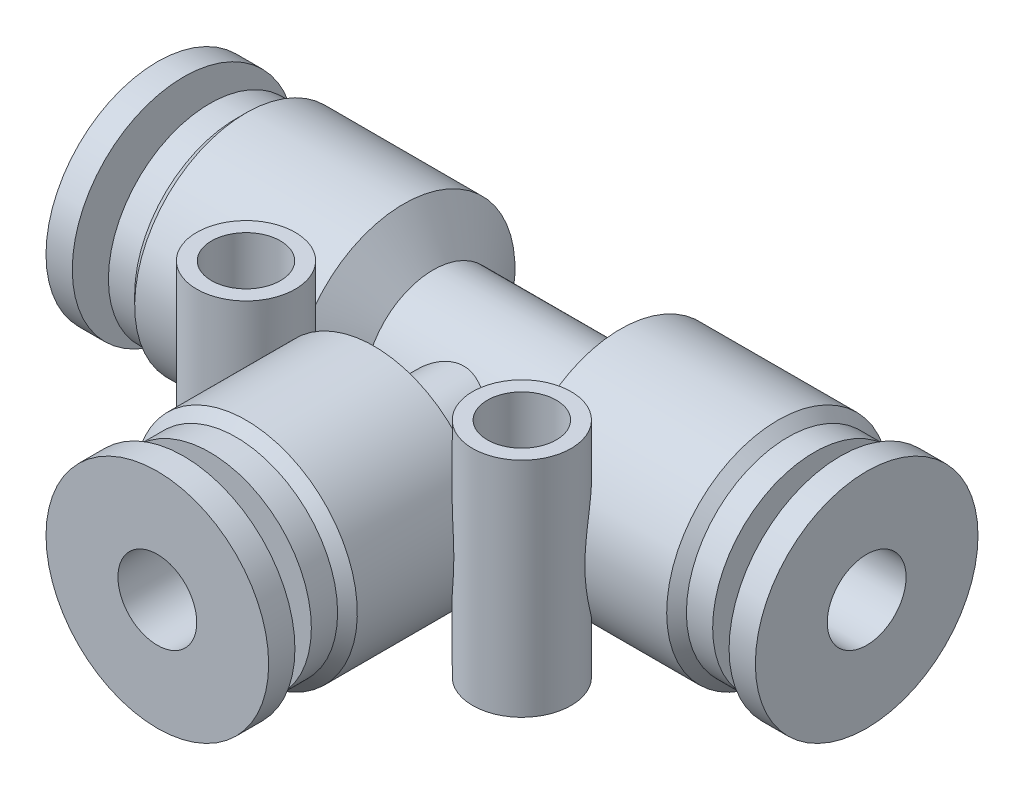
from build123d import *

# Parameters (mm, degrees)
BOSS_EXTRUDE1_DEPTH      = 5.65
BOSS_EXTRUDE1_DEPTH_BACK = 5.65
SKETCH6_R                = 2.5
SKETCH7_R                = 1.75
CUT_EXTRUDE1_DEPTH       = 22.626141761
BOSS_EXTRUDE3_DEPTH      = 1
BOSS_EXTRUDE3_DEPTH_BACK = 1
SKETCH8_W                = 10.3
SKETCH8_H                = 5
CHAMFER1_SIZE            = 0.5
SKETCH9_R                = 5.15
BOSS_EXTRUDE4_DEPTH      = 1.3333
BOSS_EXTRUDE5_START      = 1.3333
SKETCH10_R               = 5.15
BOSS_EXTRUDE5_DEPTH      = 1.3333
SKETCH11_R               = 5.15
BOSS_EXTRUDE6_DEPTH      = 1.333
SKETCH14_R               = 2
CUT_EXTRUDE2_DEPTH       = 39.36556716
CUT_EXTRUDE3_REACH       = 32.253
CUT_EXTRUDE3_END_RADIUS  = 2
SKETCH16_R               = 2


with BuildPart() as part:
    # Sketch4 → Revolve1 (revolve)
    with BuildSketch(Plane(origin=(0, 0, 0), x_dir=(1, 0, 0), z_dir=(0, 1, 0)), mode=Mode.PRIVATE) as revolve1_sk:
        Polygon((-14, 6.35), (-14, 12), (-5.5, 12), (-4, 9.85), (4, 9.85), (5.5, 12), (14, 12), (14, 6.35), align=None)
    revolve(revolve1_sk.sketch.rotate(Axis((-14, 0, -6.35), (1, 0, 0)), 180), axis=Axis((-14, 0, -6.35), (1, 0, 0)))

    # Sketch5 → Revolve2 (revolve)
    with BuildSketch(Plane(origin=(0, 0, 0), x_dir=(1, 0, 0), z_dir=(0, 1, 0)), mode=Mode.PRIVATE) as revolve2_sk:
        Polygon((-2.5, 2.85), (-2.5, 0.85), (-5.65, -0.65), (-5.65, -7.65), (0, -7.65), (0, 6.35), (-2.5, 6.35), align=None)
    revolve(revolve2_sk.sketch.rotate(Axis((0, 0, 7.65), (0, 0, -1)), 180), axis=Axis((0, 0, 7.65), (0, 0, -1)))

    # Sketch6 → Boss-Extrude1 (add, two sides: drawn at the far end of the back side and taken through both)
    with BuildSketch(Plane(origin=(0, 0, 0), x_dir=(1, 0, 0), z_dir=(0, 1, 0)).offset(-BOSS_EXTRUDE1_DEPTH_BACK)):
        with Locations(Location((-7, -0.15, 0), (0, 0, 270))):
            Circle(SKETCH6_R)
        with Locations(Location((7, -0.15, 0), (0, 0, 270))):
            Circle(SKETCH6_R)
    extrude(amount=BOSS_EXTRUDE1_DEPTH + BOSS_EXTRUDE1_DEPTH_BACK)

    # Sketch7 → Cut-Extrude1 (cut, through all)
    with BuildSketch(Plane(origin=(0, 5.65, 0), x_dir=(1, 0, 0), z_dir=(0, 1, 0))):
        with Locations(Location((7, -0.15, 0), (0, 0, 270))):
            Circle(SKETCH7_R)
        with Locations(Location((-7, -0.15, 0), (0, 0, 270))):
            Circle(SKETCH7_R)
    extrude(amount=-CUT_EXTRUDE1_DEPTH, mode=Mode.SUBTRACT)

    # Sketch8 → Boss-Extrude3 (add, two sides: drawn at the far end of the back side and taken through both)
    with BuildSketch(Plane(origin=(0, 0, 0), x_dir=(1, 0, 0), z_dir=(0, 1, 0)).offset(-BOSS_EXTRUDE3_DEPTH_BACK)):
        with Locations((0, 2)):
            Rectangle(SKETCH8_W, SKETCH8_H)
    extrude(amount=BOSS_EXTRUDE3_DEPTH + BOSS_EXTRUDE3_DEPTH_BACK)

    # Chamfer1
    chamfer1_edges = [part.edges().sort_by_distance(p)[0] for p in [
        (14, 0, -12),
        (-5.65, 0, 7.65),
        (-14, 0, -12),
    ]]
    chamfer(chamfer1_edges, length=CHAMFER1_SIZE)

    # Sketch9 → Boss-Extrude4 (add)
    with BuildSketch(Plane(origin=(14, 0, 0), x_dir=(0, 0, -1), z_dir=(1, 0, 0))):
        with Locations(Location((6.35, 0, 0), (0, 0, 180))):
            Circle(SKETCH9_R)
    extrude(amount=BOSS_EXTRUDE4_DEPTH)

    # Sketch10 → Boss-Extrude5 (add)
    with BuildSketch(Plane.ZY.offset(14).offset(BOSS_EXTRUDE5_START)):
        with Locations((-6.35, 0)):
            Circle(SKETCH10_R)
    extrude(amount=-BOSS_EXTRUDE5_DEPTH)

    # Sketch11 → Boss-Extrude6 (add)
    with BuildSketch(Plane.XY.offset(7.65)):
        with Locations(Location((0, 0, 0), (0, 0, 180))):
            Circle(SKETCH11_R)
    extrude(amount=BOSS_EXTRUDE6_DEPTH)

    # Sketch12 → Revolve3 (revolve)
    with BuildSketch(Plane(origin=(0, 0, 0), x_dir=(1, 0, 0), z_dir=(0, 1, 0))):
        Polygon((15.3333, 6.35), (17.99996, 6.35), (17.99996, 12), (16.66663, 12), (16.66663, 9.35), (15.3333, 9.35), align=None)
        Polygon((-16.66663, 9.35), (-15.3333, 9.35), (-15.3333, 6.35), (-17.99996, 6.35), (-17.99996, 12), (-16.66663, 12), align=None)
    revolve(axis=Axis((-15.3333, 0, -6.35), (-1, 0, 0)))

    # Sketch13 → Revolve4 (revolve)
    with BuildSketch(Plane(origin=(0, 0, 0), x_dir=(1, 0, 0), z_dir=(0, 1, 0))):
        Polygon((0, -8.983), (0, -11.64966), (-5.65, -11.64966), (-5.65, -10.31633), (-3, -10.31633), (-3, -8.983), align=None)
    revolve(axis=Axis((0, 0, 8.983), (0, 0, 1)))

    # Sketch14 → Cut-Extrude2 (cut, through all)
    with BuildSketch(Plane(origin=(17.99996, 0, 0), x_dir=(0, 0, -1), z_dir=(1, 0, 0))):
        with Locations((6.35, 0)):
            Circle(SKETCH14_R)
    extrude(amount=-CUT_EXTRUDE2_DEPTH, mode=Mode.SUBTRACT)

    # Cut-Extrude3: up to this cylinder (the profile starts outside it)
    cut_extrude3_end = Plane(origin=(0, 0, -6.35), z_dir=(1, 0, 0)) * Cylinder(CUT_EXTRUDE3_END_RADIUS, 69.506, mode=Mode.PRIVATE)
    # Sketch16 → Cut-Extrude3 (cut, up to the surface)
    with BuildSketch(Plane.XY.offset(11.64966), mode=Mode.PRIVATE) as cut_extrude3_sk1:
        Circle(SKETCH16_R)
    cut_extrude3_tool1 = extrude(cut_extrude3_sk1.sketch, amount=-CUT_EXTRUDE3_REACH, mode=Mode.PRIVATE) - cut_extrude3_end
    add(cut_extrude3_tool1.solids().sort_by_distance((0, 0, 11.64966))[0], mode=Mode.SUBTRACT)


solid = part.part
